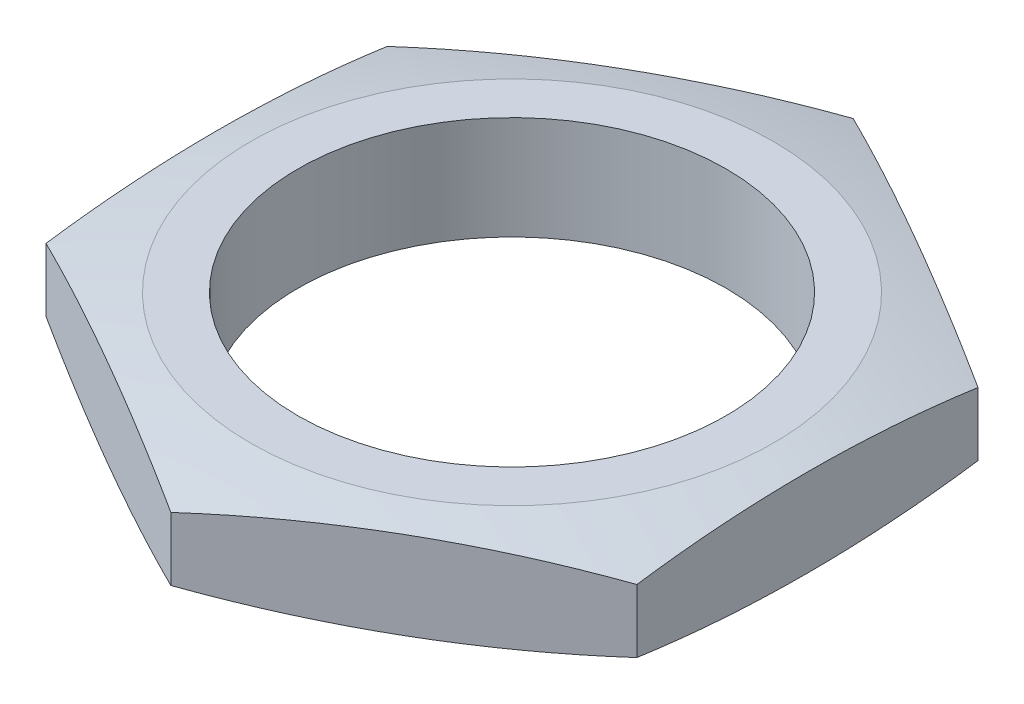
from build123d import *

# Parameters (mm, degrees)
SKETCH1_R           = 5.175
BOSS_EXTRUDE1_DEPTH = 2.5


with BuildPart() as part:
    # Sketch1 → Boss-Extrude1 (new body)
    with BuildSketch(Plane(origin=(0, 0, 0), x_dir=(1, 0, 0), z_dir=(0, 1, 0))):
        Polygon((0, 8.25), (-7.144709581, 4.125), (-7.144709581, -4.125), (0, -8.25), (7.144709581, -4.125), (7.144709581, 4.125), align=None)
        Circle(SKETCH1_R, mode=Mode.SUBTRACT)
    extrude(amount=BOSS_EXTRUDE1_DEPTH)

    # Sketch2 → Cut-Revolve3 (revolve, cut)
    with BuildSketch(Plane(origin=(1.914419162, 0, 0), x_dir=(1, 0, 0), z_dir=(0, 0, 1))):
        with BuildLine():
            Line((-1.914419162, 3.174819063), (-1.914419162, 16.07690266))
            ThreePointArc((-1.914419162, 16.07690266), (-17.205966927, 0.785354895), (-1.914419162, -14.506192869))
            Line((-1.914419162, -14.506192869), (-1.914419162, -0.674819063))
            ThreePointArc((-1.914419162, -0.674819063), (-7.281350854, -0.189682365), (-12.47429107, 1.25))
            ThreePointArc((-12.47429107, 1.25), (-7.281350854, 2.689682365), (-1.914419162, 3.174819063))
        make_face()
    revolve(axis=Axis((0, 4.297603661, 0), (0, -1, 0)), mode=Mode.SUBTRACT)


solid = part.part
